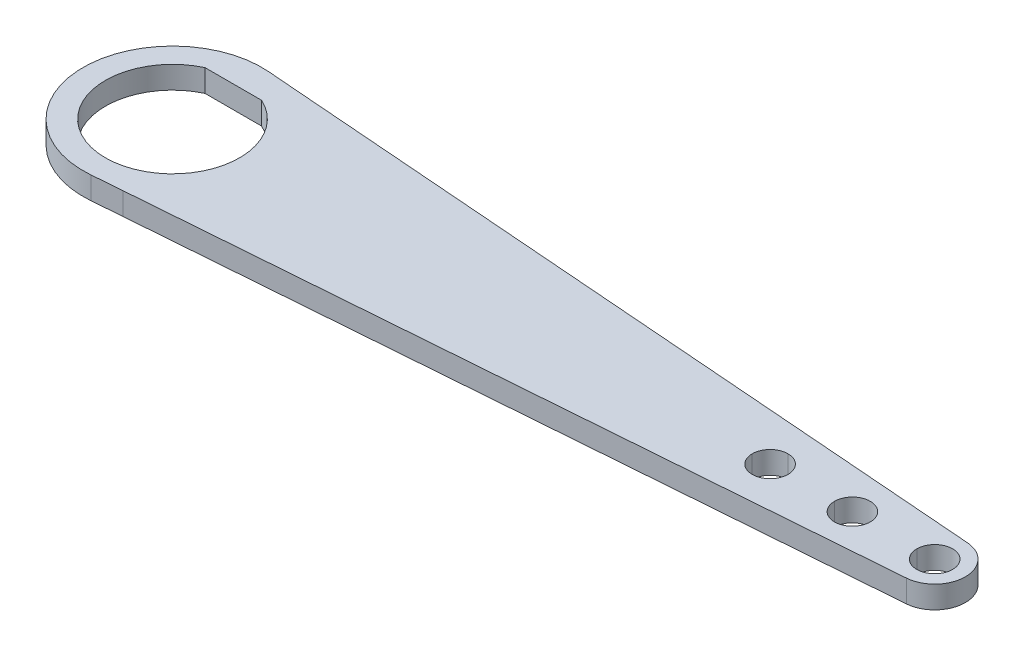
from build123d import *

# Parameters (mm, degrees)
SKETCH1_R               = 2.54
BOSS_EXTRUDE1_DEPTH     = 3.175
CUT_EXTRUDE1_DEPTH      = 114.310823319
CUT_EXTRUDE1_DEPTH_BACK = 114.310823319


with BuildPart() as part:
    # Sketch1 → Boss-Extrude1 (new body)
    with BuildSketch(Plane(origin=(0, 0, 0), x_dir=(1, 0, 0), z_dir=(0, 1, 0))):
        with BuildLine():
            Line((108.539117009, 4.335152614), (5.263477484, 12.318590912))
            ThreePointArc((5.263477484, 12.318590912), (3.157372026, 12.484449553), (1.051753091, 12.656374498))
            ThreePointArc((1.051753091, 12.656374498), (-12.7, 0), (1.051753091, -12.656374498))
            ThreePointArc((1.051753091, -12.656374498), (3.157372026, -12.484449553), (5.263477484, -12.318590912))
            Line((5.263477484, -12.318590912), (108.539117009, -4.335152614))
            ThreePointArc((108.539117009, -4.335152614), (112.55208597, 0), (108.539117009, 4.335152614))
        make_face()
        with Locations(Location((108.204, 0, 0), (0, 0, 270))):
            Circle(SKETCH1_R, mode=Mode.SUBTRACT)
        with Locations(Location((96.52, 0, 0), (0, 0, 270))):
            Circle(SKETCH1_R, mode=Mode.SUBTRACT)
        with Locations(Location((84.836, 0, 0), (0, 0, 270))):
            Circle(SKETCH1_R, mode=Mode.SUBTRACT)
    extrude(amount=BOSS_EXTRUDE1_DEPTH)

    # Sketch3 → Cut-Extrude1 (cut, two sides: drawn at the far end of the back side and taken through both)
    with BuildSketch(Plane(origin=(0, 0, 0), x_dir=(1, 0, 0), z_dir=(0, 1, 0)).offset(-CUT_EXTRUDE1_DEPTH_BACK)):
        with BuildLine():
            Line((-4.018100173, 8.636), (4.018100173, 8.636))
            ThreePointArc((4.018100173, 8.636), (0, -9.525), (-4.018100173, 8.636))
        make_face()
    extrude(amount=CUT_EXTRUDE1_DEPTH + CUT_EXTRUDE1_DEPTH_BACK, mode=Mode.SUBTRACT)


solid = part.part
